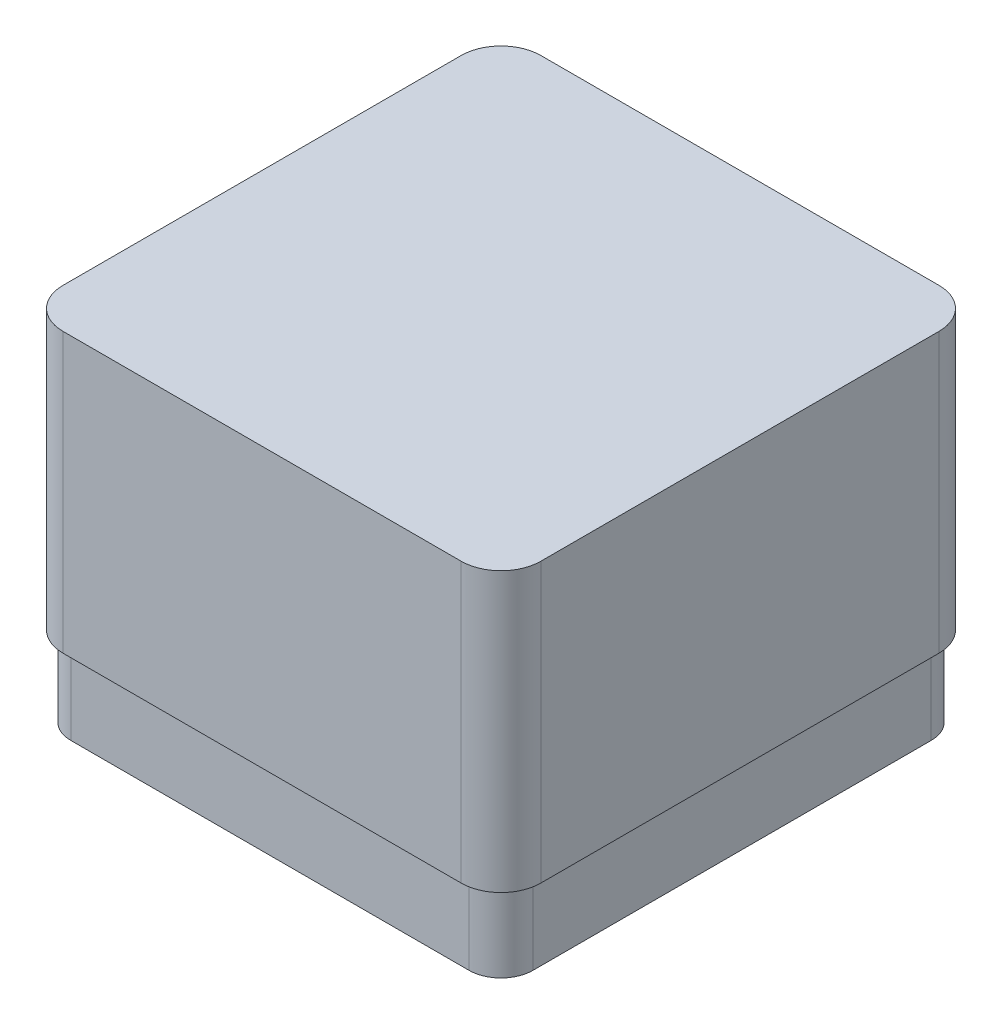
from build123d import *

# Parameters (mm, degrees)
SKETCH_1_W          = 120
SKETCH_1_H          = 120
EXTRUDE_1_DEPTH     = 90
FILLET_1_R          = 10
SHELL_1_T           = -4
CUT_EXTRUDE_START   = -20
CUT_EXTRUDE_1_DEPTH = 20


with BuildPart() as part:
    # 草图1 → 凸台-拉伸1 (new body)
    with BuildSketch(Plane(origin=(0, 0, 0), x_dir=(1, 0, 0), z_dir=(0, 1, 0))):
        with Locations((60, 60)):
            Rectangle(SKETCH_1_W, SKETCH_1_H)
    extrude(amount=EXTRUDE_1_DEPTH)

    # 圆角1
    fillet_1_edges = [part.edges().sort_by_distance(p)[0] for p in [
        (0, 45, -120),
        (120, 45, -120),
        (120, 45, 0),
        (0, 45, 0),
    ]]
    fillet(fillet_1_edges, radius=FILLET_1_R)

    # 抽壳1
    shell_1_openings = [part.faces().sort_by_distance(p)[0] for p in [
        (60, 0, -60),
    ]]
    offset(amount=SHELL_1_T, openings=shell_1_openings, kind=Kind.INTERSECTION)

    # 草图13 → 切除-拉伸1 (cut)
    with BuildSketch(Plane.XZ.offset(CUT_EXTRUDE_START)):
        with BuildLine():
            Line((120, -110), (120, -10))
            ThreePointArc((120, -10), (117.071067812, -2.928932188), (110, 0))
            Line((110, 0), (10, 0))
            ThreePointArc((10, 0), (2.928932188, -2.928932188), (0, -10))
            Line((0, -10), (0, -110))
            ThreePointArc((0, -110), (2.928932188, -117.071067812), (10, -120))
            Line((10, -120), (110, -120))
            ThreePointArc((110, -120), (117.071067812, -117.071067812), (120, -110))
        make_face()
        with BuildLine():
            Line((118, -110), (118, -10))
            ThreePointArc((118, -10), (115.656854249, -4.343145751), (110, -2))
            Line((110, -2), (10, -2))
            ThreePointArc((10, -2), (4.343145751, -4.343145751), (2, -10))
            Line((2, -10), (2, -110))
            ThreePointArc((2, -110), (4.343145751, -115.656854249), (10, -118))
            Line((10, -118), (110, -118))
            ThreePointArc((110, -118), (115.656854249, -115.656854249), (118, -110))
        make_face(mode=Mode.SUBTRACT)
    extrude(amount=CUT_EXTRUDE_1_DEPTH, mode=Mode.SUBTRACT)


solid = part.part
